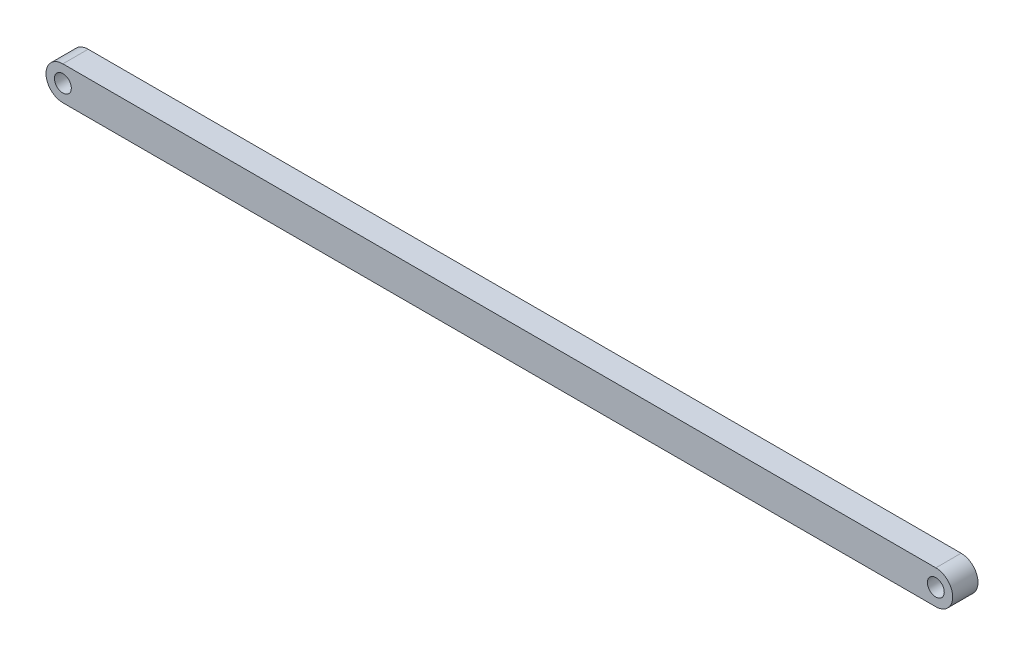
from build123d import *

# Parameters (mm, degrees)
SKETCH1_R           = 1
BOSS_EXTRUDE1_DEPTH = 3


with BuildPart() as part:
    # Sketch1 → Boss-Extrude1 (new body)
    with BuildSketch(Plane.XY):
        with BuildLine():
            Line((0, 2), (103.5, 2))
            ThreePointArc((103.5, 2), (105.5, 0), (103.5, -2))
            Line((103.5, -2), (0, -2))
            ThreePointArc((0, -2), (-2, 0), (0, 2))
        make_face()
        Circle(SKETCH1_R, mode=Mode.SUBTRACT)
        with Locations((103.5, 0)):
            Circle(SKETCH1_R, mode=Mode.SUBTRACT)
    extrude(amount=BOSS_EXTRUDE1_DEPTH)


solid = part.part
